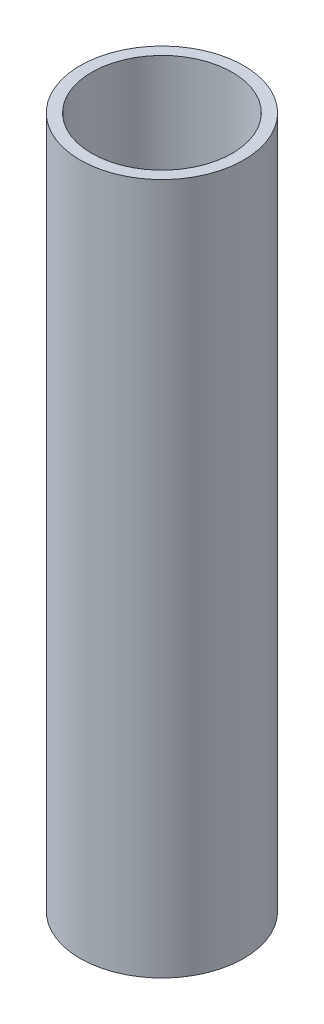
from build123d import *

# Parameters (mm, degrees)
SKETCH1_R           = 8.875
SKETCH1_R_2         = 7.625
BOSS_EXTRUDE1_DEPTH = 75


with BuildPart() as part:
    # Sketch1 → Boss-Extrude1 (new body)
    with BuildSketch(Plane(origin=(0, 0, 0), x_dir=(1, 0, 0), z_dir=(0, 1, 0))):
        with Locations(Location((0, 0, 0), (0, 0, 270))):
            Circle(SKETCH1_R)
        with Locations(Location((0, 0, 0), (0, 0, 270))):
            Circle(SKETCH1_R_2, mode=Mode.SUBTRACT)
    extrude(amount=BOSS_EXTRUDE1_DEPTH)


solid = part.part
